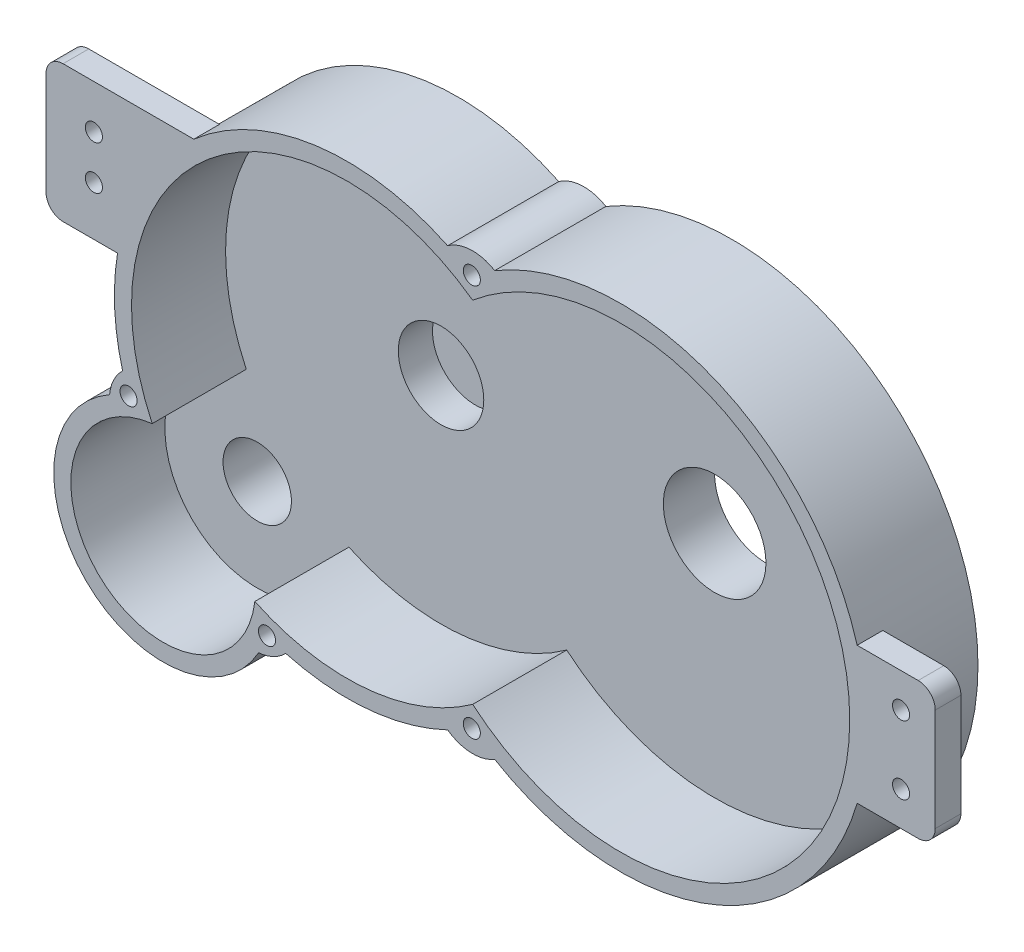
from build123d import *
from build123d.topology import SkipClean

# Parameters (mm, degrees)
SKETCH1_R           = 2.5
SKETCH1_R_2         = 15
SKETCH1_R_3         = 12.5
BOSS_EXTRUDE2_DEPTH = 5
SKETCH1_5_R         = 2.5
BOSS_EXTRUDE3_DEPTH = 32.5
SKETCH1_6_R         = 2.5
CUT_EXTRUDE1_DEPTH  = 25
SKETCH1_7_R         = 20
SKETCH1_7_R_2       = 17.5
BOSS_EXTRUDE4_DEPTH = 10
CUT_EXTRUDE2_START  = -5
SKETCH1_8_R         = 15
SKETCH1_8_R_2       = 12.5
CUT_EXTRUDE2_DEPTH  = 5
SKETCH1_9_R         = 15
SKETCH1_9_R_2       = 10
BOSS_EXTRUDE5_DEPTH = 10
SKETCH1_10_R        = 10
CUT_EXTRUDE4_DEPTH  = 5
CUT_EXTRUDE5_START  = -10
SKETCH1_11_R        = 15
CUT_EXTRUDE5_DEPTH  = 10
SKETCH1_12_R        = 2.5
BOSS_EXTRUDE7_DEPTH = 32.5
SKETCH1_14_R        = 2.5
CUT_EXTRUDE7_DEPTH  = 25


with BuildPart() as part:
    # Sketch1 → Boss-Extrude2 (new body)
    with BuildSketch(Plane.XY):
        with BuildLine():
            ThreePointArc((-36.80587195, 61.881562601), (-43.775658453, 63.659612747), (-50.571382583, 61.302173509))
            ThreePointArc((-50.571382583, 61.302173509), (-123.538014062, 52.234484122), (-145.600267844, -17.905442155))
            ThreePointArc((-145.600267844, -17.905442155), (-148.223407914, -21.525256537), (-149.405122728, -25.836575371))
            ThreePointArc((-149.405122728, -25.836575371), (-156.367532368, -76.367532368), (-105.836575371, -69.405122728))
            ThreePointArc((-105.836575371, -69.405122728), (-101.525256537, -68.223407914), (-97.905442155, -65.600267844))
            ThreePointArc((-97.905442155, -65.600267844), (-73.850667048, -67.721382917), (-50.571382583, -61.302173509))
            ThreePointArc((-50.571382583, -61.302173509), (-43.775658453, -63.659612747), (-36.80587195, -61.881562601))
            ThreePointArc((-36.80587195, -61.881562601), (72, 0), (-36.80587195, 61.881562601))
        make_face()
        with Locations((-103.38049856, -63.85414855)):
            Circle(SKETCH1_R, mode=Mode.SUBTRACT)
        with Locations((-43.5, -57.373774497)):
            Circle(SKETCH1_R, mode=Mode.SUBTRACT)
        with Locations((-143.85414855, -23.38049856)):
            Circle(SKETCH1_R, mode=Mode.SUBTRACT)
        with Locations((-43.5, 57.373774497)):
            Circle(SKETCH1_R, mode=Mode.SUBTRACT)
        Circle(SKETCH1_R_2, mode=Mode.SUBTRACT)
        with Locations((-80, 0)):
            Circle(SKETCH1_R_3, mode=Mode.SUBTRACT)
    extrude(amount=BOSS_EXTRUDE2_DEPTH)

    # Sketch1<5> → Boss-Extrude3 (add)
    with BuildSketch(Plane.XY):
        with BuildLine():
            Line((92, -15), (92, 15))
            ThreePointArc((92, 15), (90.535533906, 18.535533906), (87, 20))
            Line((87, 20), (69.166465863, 20))
            ThreePointArc((69.166465863, 20), (26.463528319, 66.9602992), (-36.80587195, 61.881562601))
            ThreePointArc((-36.80587195, 61.881562601), (-43.775658453, 63.659612747), (-50.571382583, 61.302173509))
            ThreePointArc((-50.571382583, 61.302173509), (-123.538014062, 52.234484122), (-145.600267844, -17.905442155))
            ThreePointArc((-145.600267844, -17.905442155), (-148.223407914, -21.525256537), (-149.405122728, -25.836575371))
            ThreePointArc((-149.405122728, -25.836575371), (-156.367532368, -76.367532368), (-105.836575371, -69.405122728))
            ThreePointArc((-105.836575371, -69.405122728), (-101.525256537, -68.223407914), (-97.905442155, -65.600267844))
            ThreePointArc((-97.905442155, -65.600267844), (-73.850667048, -67.721382917), (-50.571382583, -61.302173509))
            ThreePointArc((-50.571382583, -61.302173509), (-43.775658453, -63.659612747), (-36.80587195, -61.881562601))
            ThreePointArc((-36.80587195, -61.881562601), (26.463528319, -66.9602992), (69.166465863, -20))
            Line((69.166465863, -20), (87, -20))
            ThreePointArc((87, -20), (90.535533906, -18.535533906), (92, -15))
        make_face()
        with Locations((82, -10)):
            Circle(SKETCH1_5_R, mode=Mode.SUBTRACT)
        with Locations((82, 10)):
            Circle(SKETCH1_5_R, mode=Mode.SUBTRACT)
        with Locations((-43.5, 57.373774497)):
            Circle(SKETCH1_5_R, mode=Mode.SUBTRACT)
        with Locations((-103.38049856, -63.85414855)):
            Circle(SKETCH1_5_R, mode=Mode.SUBTRACT)
        with Locations((-43.5, -57.373774497)):
            Circle(SKETCH1_5_R, mode=Mode.SUBTRACT)
        with Locations((-143.85414855, -23.38049856)):
            Circle(SKETCH1_5_R, mode=Mode.SUBTRACT)
        with BuildLine():
            ThreePointArc((-43.25, 51.17067031), (67, 0), (-43.25, -51.17067031))
            ThreePointArc((-43.25, -51.17067031), (-74.302823883, -62.741869468), (-106.931982072, -56.953211864))
            ThreePointArc((-106.931982072, -56.953211864), (-152.831998462, -72.831998462), (-136.953211864, -26.931982072))
            ThreePointArc((-136.953211864, -26.931982072), (-120.336689499, 48.393713231), (-43.25, 51.17067031))
        make_face(mode=Mode.SUBTRACT)
    extrude(amount=BOSS_EXTRUDE3_DEPTH)

    # Sketch1<6> → Cut-Extrude1 (cut)
    with SkipClean():  # the faces are left unmerged after this step: merging them gives an invalid solid
        with BuildSketch(Plane.XY):
            with BuildLine():
                Line((92, -15), (92, 0))
                Line((92, 0), (92, 15))
                ThreePointArc((92, 15), (90.535533906, 18.535533906), (87, 20))
                Line((87, 20), (69.166465863, 20))
                ThreePointArc((69.166465863, 20), (72, 0), (69.166465863, -20))
                Line((69.166465863, -20), (87, -20))
                ThreePointArc((87, -20), (90.535533906, -18.535533906), (92, -15))
            make_face()
            with Locations((82, -10)):
                Circle(SKETCH1_6_R, mode=Mode.SUBTRACT)
            with Locations((82, 10)):
                Circle(SKETCH1_6_R, mode=Mode.SUBTRACT)
        extrude(amount=CUT_EXTRUDE1_DEPTH, mode=Mode.SUBTRACT)

    # Sketch1<7> → Boss-Extrude4 (add)
    with SkipClean():  # the faces are left unmerged after this step: merging them gives an invalid solid
        with BuildSketch(Plane.XY):
            Circle(SKETCH1_7_R)
            with Locations((-80, 0)):
                Circle(SKETCH1_7_R_2)
        extrude(amount=-BOSS_EXTRUDE4_DEPTH)

    # Sketch1<8> → Cut-Extrude2 (cut)
    with SkipClean():  # the faces are left unmerged after this step: merging them gives an invalid solid
        with BuildSketch(Plane.XY.offset(CUT_EXTRUDE2_START)):
            Circle(SKETCH1_8_R)
            with Locations((-80, 0)):
                Circle(SKETCH1_8_R_2)
        extrude(amount=CUT_EXTRUDE2_DEPTH, mode=Mode.SUBTRACT)

    # Sketch1<9> → Boss-Extrude5 (add)
    with SkipClean():  # the faces are left unmerged after this step: merging them gives an invalid solid
        with BuildSketch(Plane.XY):
            with Locations((-133.74011537, -53.74011537)):
                Circle(SKETCH1_9_R)
            with Locations((-133.74011537, -53.74011537)):
                Circle(SKETCH1_9_R_2, mode=Mode.SUBTRACT)
        extrude(amount=-BOSS_EXTRUDE5_DEPTH)

    # Sketch1<10> → Cut-Extrude4 (cut, symmetric)
    with SkipClean():  # the faces are left unmerged after this step: merging them gives an invalid solid
        with BuildSketch(Plane.XY):
            with Locations((-133.74011537, -53.74011537)):
                Circle(SKETCH1_10_R)
        extrude(amount=CUT_EXTRUDE4_DEPTH, both=True, mode=Mode.SUBTRACT)

    # Sketch1<11> → Cut-Extrude5 (cut)
    with SkipClean():  # the faces are left unmerged after this step: merging them gives an invalid solid
        with BuildSketch(Plane.XY.offset(CUT_EXTRUDE5_START)):
            Circle(SKETCH1_11_R)
        extrude(amount=CUT_EXTRUDE5_DEPTH, mode=Mode.SUBTRACT)

    # Sketch1<12> → Boss-Extrude7 (add)
    with SkipClean():  # the faces are left unmerged after this step: merging them gives an invalid solid
        with BuildSketch(Plane.XY):
            with BuildLine():
                ThreePointArc((-147.07619641, 11.17067031), (-139.39821809, 33.103650671), (-124.783507009, 51.17067031))
                Line((-124.783507009, 51.17067031), (-143.891753504, 51.17067031))
                Line((-143.891753504, 51.17067031), (-163, 51.17067031))
                ThreePointArc((-163, 51.17067031), (-166.535533906, 49.706204216), (-168, 46.17067031))
                Line((-168, 46.17067031), (-168, 16.17067031))
                ThreePointArc((-168, 16.17067031), (-166.535533906, 12.635136404), (-163, 11.17067031))
                Line((-163, 11.17067031), (-147.07619641, 11.17067031))
            make_face()
            with Locations((-154, 25.585335155)):
                Circle(SKETCH1_12_R, mode=Mode.SUBTRACT)
            with Locations((-154, 38.378002733)):
                Circle(SKETCH1_12_R, mode=Mode.SUBTRACT)
        extrude(amount=BOSS_EXTRUDE7_DEPTH)

    # Sketch1<14> → Cut-Extrude7 (cut)
    with SkipClean():  # the faces are left unmerged after this step: merging them gives an invalid solid
        with BuildSketch(Plane.XY):
            with BuildLine():
                ThreePointArc((-147.07619641, 11.17067031), (-139.39821809, 33.103650671), (-124.783507009, 51.17067031))
                Line((-124.783507009, 51.17067031), (-143.891753504, 51.17067031))
                Line((-143.891753504, 51.17067031), (-163, 51.17067031))
                ThreePointArc((-163, 51.17067031), (-166.535533906, 49.706204216), (-168, 46.17067031))
                Line((-168, 46.17067031), (-168, 16.17067031))
                ThreePointArc((-168, 16.17067031), (-166.535533906, 12.635136404), (-163, 11.17067031))
                Line((-163, 11.17067031), (-147.07619641, 11.17067031))
            make_face()
            with Locations((-154, 25.585335155)):
                Circle(SKETCH1_14_R, mode=Mode.SUBTRACT)
            with Locations((-154, 38.378002733)):
                Circle(SKETCH1_14_R, mode=Mode.SUBTRACT)
        extrude(amount=CUT_EXTRUDE7_DEPTH, mode=Mode.SUBTRACT)


solid = part.part
